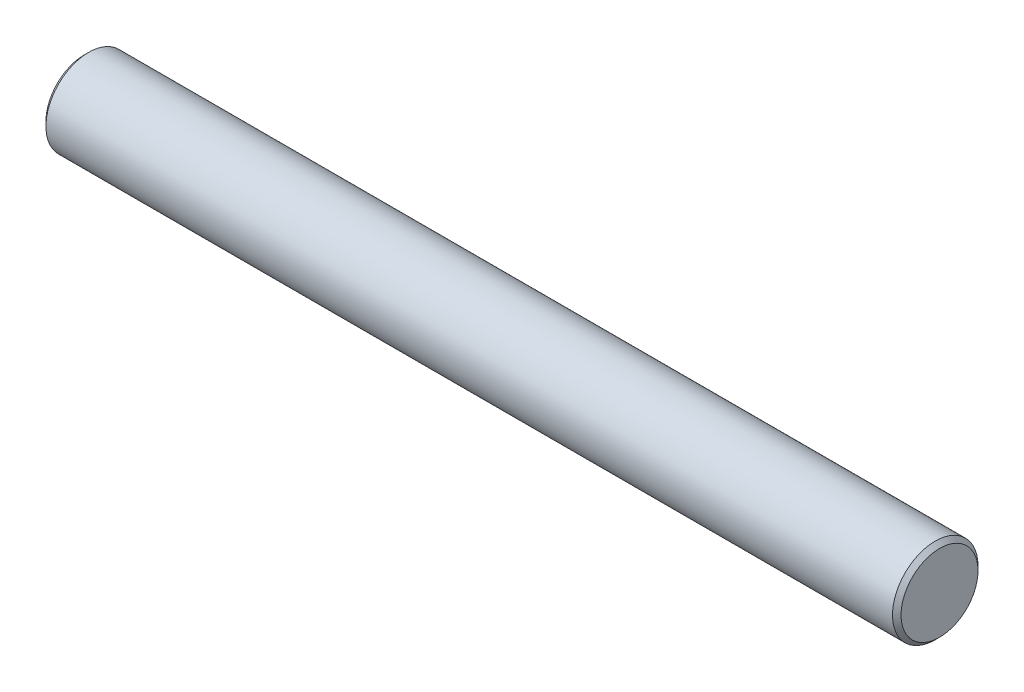
from build123d import *

# Parameters (mm, degrees)
SKETCH1_R           = 2.5
BOSS_EXTRUDE1_DEPTH = 50
CHAMFER1_SIZE       = 0.25


with BuildPart() as part:
    # Sketch1 → Boss-Extrude1 (new body)
    with BuildSketch(Plane(origin=(0, 0, 0), x_dir=(0, -1, 0), z_dir=(-1, 0, 0))):
        with Locations(Location((0, 0, 0), (0, 0, 270))):
            Circle(SKETCH1_R)
    extrude(amount=-BOSS_EXTRUDE1_DEPTH)

    # Chamfer1
    chamfer1_edges = [part.edges().sort_by_distance(p)[0] for p in [
        (0, 0, 2.5),
        (50, 0, 2.5),
    ]]
    chamfer(chamfer1_edges, length=CHAMFER1_SIZE)


solid = part.part
